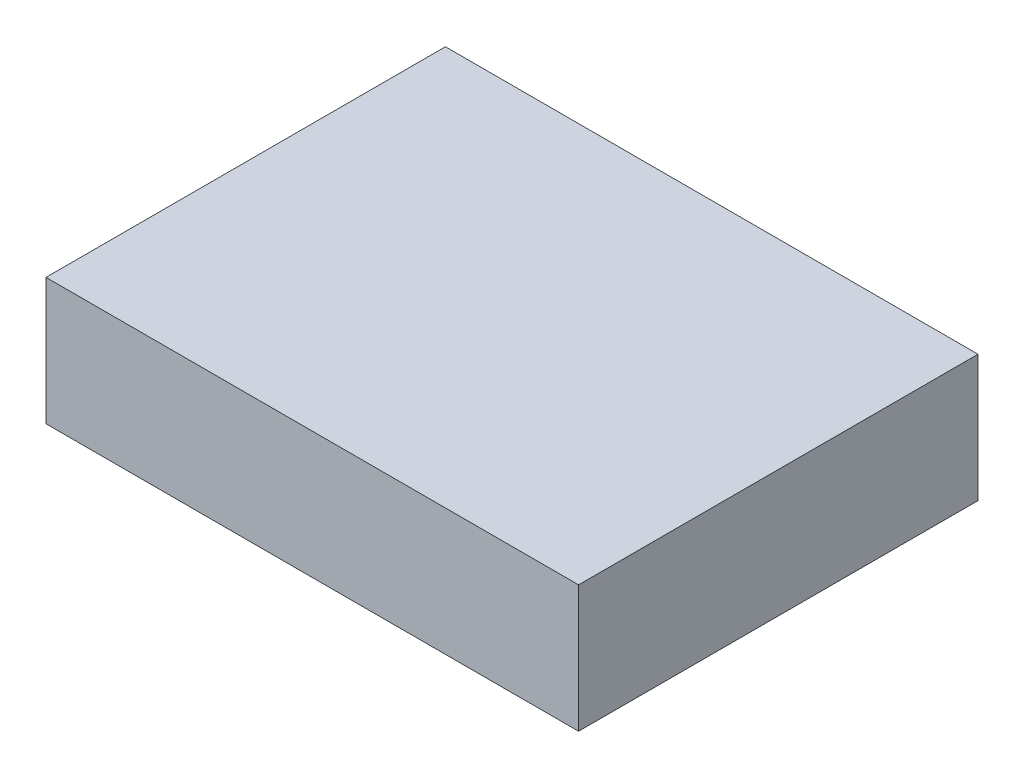
from build123d import *

# Parameters (mm, degrees)
SKETCH_1_W          = 210
SKETCH_1_H          = 157.5
EXTRUDE_1_DEPTH     = 10
SKETCH_2_W          = 210
SKETCH_2_H          = 157.5
EXTRUDE_2_DEPTH     = 40
SKETCH_3_R          = 3.79044749
SKETCH_3_R_2        = 3.951540246
CUT_EXTRUDE_1_DEPTH = 40


with BuildPart() as part:
    # 草图1 → 凸台-拉伸1 (new body)
    with BuildSketch(Plane(origin=(0, 0, 0), x_dir=(1, 0, 0), z_dir=(0, 1, 0))):
        with Locations((105, 78.75)):
            Rectangle(SKETCH_1_W, SKETCH_1_H)
        with BuildLine():
            Line((34.056494748, 172.5), (34.056494748, 157.5))
            Line((34.056494748, 157.5), (59.056494748, 157.5))
            Line((59.056494748, 157.5), (59.056494748, 172.5))
            ThreePointArc((59.056494748, 172.5), (56.12756256, 179.571067812), (49.056494748, 182.5))
            Line((49.056494748, 182.5), (44.056494748, 182.5))
            ThreePointArc((44.056494748, 182.5), (36.985426936, 179.571067812), (34.056494748, 172.5))
        make_face()
        with BuildLine():
            Line((156.491132728, 157.5), (181.491132728, 157.5))
            Line((181.491132728, 157.5), (181.491132728, 172.5))
            ThreePointArc((181.491132728, 172.5), (178.56220054, 179.571067812), (171.491132728, 182.5))
            Line((171.491132728, 182.5), (166.491132728, 182.5))
            ThreePointArc((166.491132728, 182.5), (159.420064916, 179.571067812), (156.491132728, 172.5))
            Line((156.491132728, 172.5), (156.491132728, 157.5))
        make_face()
    extrude(amount=EXTRUDE_1_DEPTH)

    # 草图2 → 凸台-拉伸2 (add)
    with BuildSketch(Plane(origin=(0, 10, 0), x_dir=(1, 0, 0), z_dir=(0, 1, 0))):
        with Locations((105, 78.75)):
            Rectangle(SKETCH_2_W, SKETCH_2_H)
    extrude(amount=EXTRUDE_2_DEPTH)

    # 草图3 → 切除-拉伸1 (cut)
    with BuildSketch(Plane(origin=(0, 10, 0), x_dir=(1, 0, 0), z_dir=(0, 1, 0))):
        with Locations(Location((46.4811838, 172.938422578, 0), (0, 0, 270))):
            Circle(SKETCH_3_R)
        with Locations(Location((168.209255667, 172.938422578, 0), (0, 0, 270))):
            Circle(SKETCH_3_R_2)
    extrude(amount=-CUT_EXTRUDE_1_DEPTH, mode=Mode.SUBTRACT)


solid = part.part
